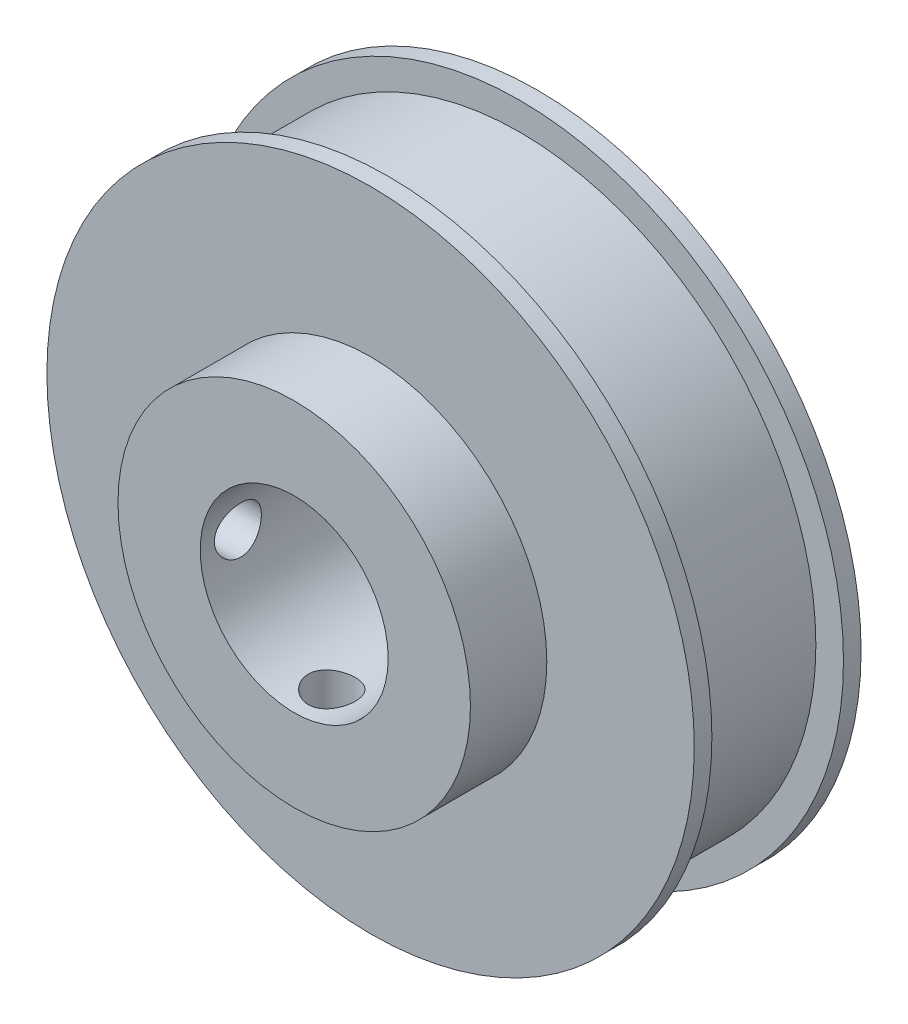
from build123d import *

# Parameters (mm, degrees)
CROQUIS1_R              = 27.55
SALIENTE_EXTRUIR1_DEPTH = 1.5
CROQUIS2_R              = 25.2
SALIENTE_EXTRUIR2_DEPTH = 11.2
CROQUIS3_R              = 27.55
SALIENTE_EXTRUIR3_DEPTH = 1.5
CROQUIS8_R              = 15
SALIENTE_EXTRUIR5_DEPTH = 6.5
CROQUIS6_R              = 2
CORTAR_EXTRUIR3_DEPTH   = 45.119100172
CROQUIS5_R              = 2
CORTAR_EXTRUIR2_DEPTH   = 45.119100219
CROQUIS4_R              = 8
CORTAR_EXTRUIR1_DEPTH   = 45.119100172


with BuildPart() as part:
    # Croquis1 → Saliente-Extruir1 (new body)
    with BuildSketch(Plane.XY):
        Circle(CROQUIS1_R)
    extrude(amount=SALIENTE_EXTRUIR1_DEPTH)

    # Croquis2 → Saliente-Extruir2 (add)
    with BuildSketch(Plane.XY.offset(1.5)):
        Circle(CROQUIS2_R)
    extrude(amount=SALIENTE_EXTRUIR2_DEPTH)

    # Croquis3 → Saliente-Extruir3 (add)
    with BuildSketch(Plane.XY.offset(12.7)):
        Circle(CROQUIS3_R)
    extrude(amount=SALIENTE_EXTRUIR3_DEPTH)

    # Croquis8 → Saliente-Extruir5 (add)
    with BuildSketch(Plane.XY.offset(14.2)):
        with Locations(Location((0, 0, 0), (0, 0, 180))):
            Circle(CROQUIS8_R)
    extrude(amount=SALIENTE_EXTRUIR5_DEPTH)

    # Croquis6 → Cortar-Extruir3 (cut, through all)
    with BuildSketch(Plane(origin=(0, 0, 0), x_dir=(1, 0, 0), z_dir=(0, 1, 0))):
        with Locations(Location((0, -17.5, 0), (0, 0, 270))):
            Circle(CROQUIS6_R)
    extrude(amount=-CORTAR_EXTRUIR3_DEPTH, mode=Mode.SUBTRACT)

    # Croquis5 → Cortar-Extruir2 (cut, through all)
    with BuildSketch(Plane(origin=(0, 0, 0), x_dir=(0, 0, -1), z_dir=(1, 0, 0))):
        with Locations(Location((-17.5, 0, 0), (0, 0, 180))):
            Circle(CROQUIS5_R)
    extrude(amount=-CORTAR_EXTRUIR2_DEPTH, mode=Mode.SUBTRACT)

    # Croquis4 → Cortar-Extruir1 (cut, through all)
    with BuildSketch(Plane.XY.offset(20.7)):
        Circle(CROQUIS4_R)
    extrude(amount=-CORTAR_EXTRUIR1_DEPTH, mode=Mode.SUBTRACT)


solid = part.part
